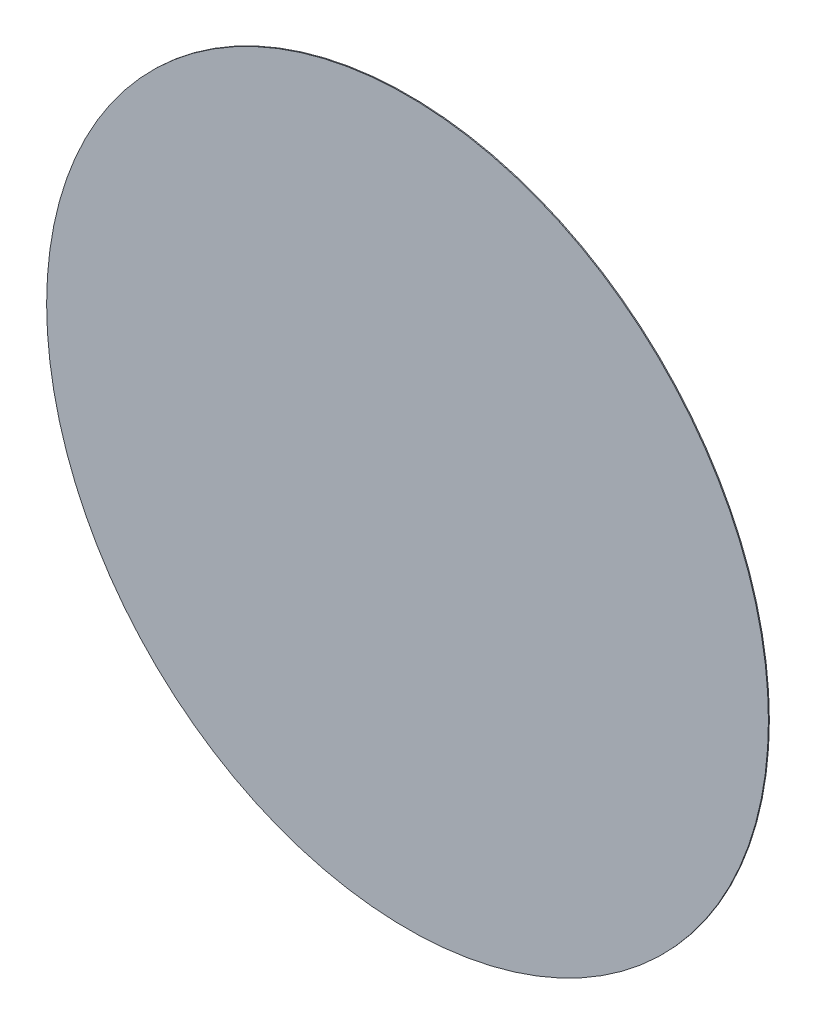
from build123d import *

# Parameters (mm, degrees)
SKETCH1_R           = 25
BOSS_EXTRUDE1_DEPTH = 0.065


with BuildPart() as part:
    # Sketch1 → Boss-Extrude1 (new body)
    with BuildSketch(Plane.XY):
        Circle(SKETCH1_R)
    extrude(amount=BOSS_EXTRUDE1_DEPTH)


solid = part.part
